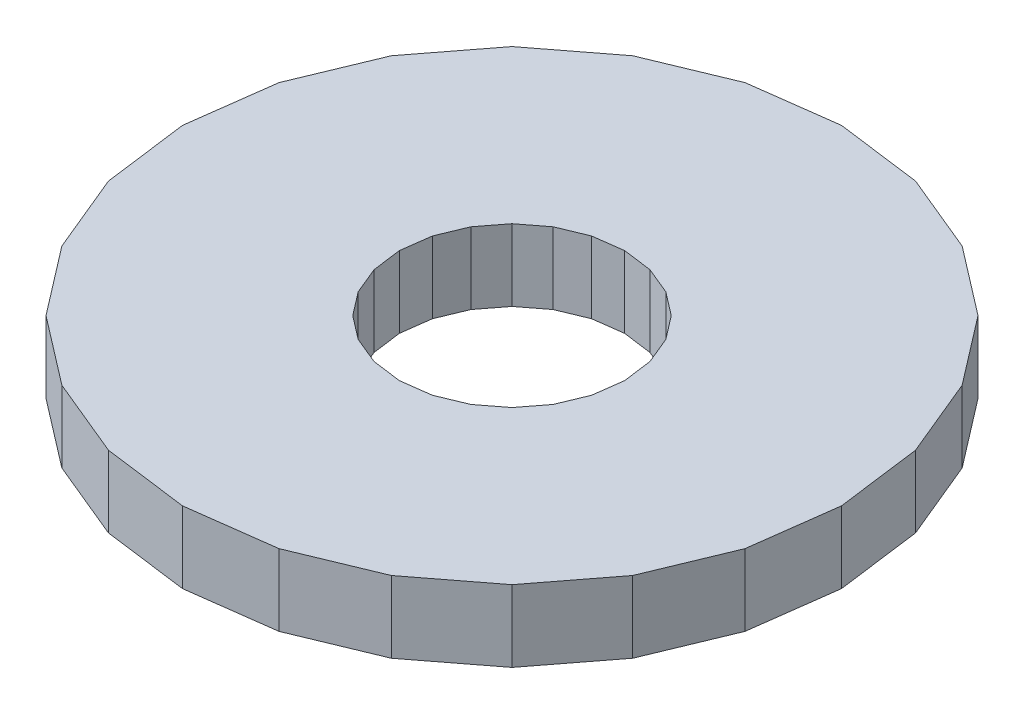
from build123d import *

# Parameters (mm, degrees)
BOSS_EXTRUDE1_DEPTH = 19.05


with BuildPart() as part:
    # Sketch1 → Boss-Extrude1 (new body)
    with BuildSketch(Plane(origin=(0, 0, 0), x_dir=(1, 0, 0), z_dir=(0, 1, 0))):
        Polygon((87.568631288, 0), (84.584802534, 22.664429531), (75.83665927, 43.784315644), (61.920373003, 61.920373003), (43.784315644, 75.83665927), (22.664429531, 84.584802534), (0, 87.568631288), (-22.664429531, 84.584802534), (-43.784315644, 75.83665927), (-61.920373003, 61.920373003), (-75.83665927, 43.784315644), (-84.584802534, 22.664429531), (-87.568631288, 0), (-84.584802534, -22.664429531), (-75.83665927, -43.784315644), (-61.920373003, -61.920373003), (-43.784315644, -75.83665927), (-22.664429531, -84.584802534), (0, -87.568631288), (22.664429531, -84.584802534), (43.784315644, -75.83665927), (61.920373003, -61.920373003), (75.83665927, -43.784315644), (84.584802534, -22.664429531), align=None)
        Polygon((29.925486191, 0), (28.905799976, 7.74528576), (25.916231262, 14.962743096), (21.160514216, 21.160514216), (14.962743096, 25.916231262), (7.74528576, 28.905799976), (0, 29.925486191), (-7.74528576, 28.905799976), (-14.962743096, 25.916231262), (-21.160514216, 21.160514216), (-25.916231262, 14.962743096), (-28.905799976, 7.74528576), (-29.925486191, 0), (-28.905799976, -7.74528576), (-25.916231262, -14.962743096), (-21.160514216, -21.160514216), (-14.962743096, -25.916231262), (-7.74528576, -28.905799976), (0, -29.925486191), (7.74528576, -28.905799976), (14.962743096, -25.916231262), (21.160514216, -21.160514216), (25.916231262, -14.962743096), (28.905799976, -7.74528576), align=None, mode=Mode.SUBTRACT)
    extrude(amount=BOSS_EXTRUDE1_DEPTH)


solid = part.part
